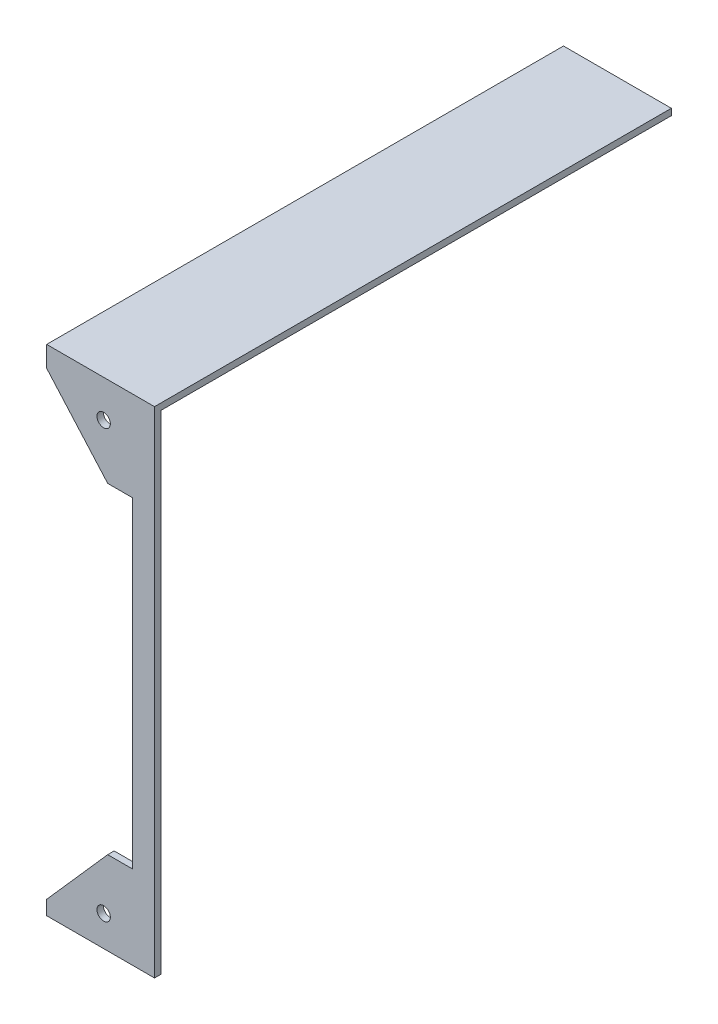
from build123d import *

# Parameters (mm, degrees)
BOSS_EXTRUDE1_DEPTH = 1.5875
SKETCH2_W           = 26.5
SKETCH2_H           = 127
BOSS_EXTRUDE2_DEPTH = 1.5875


with BuildPart() as part:
    # Sketch1 → Boss-Extrude1 (new body)
    with BuildSketch(Plane.XY):
        Polygon((-26.5, 120), (0, 120), (0, 0), (-26.5, 0), (-26.5, 3.5), (-11.5, 20.5), (-5.4, 20.5), (-5.4, 99.5), (-11.5, 99.5), (-26.5, 116.5), align=None)
        with BuildLine():
            ThreePointArc((-14.15, 112.5), (-12.5, 110.85), (-10.85, 112.5))
            ThreePointArc((-10.85, 112.5), (-12.5, 114.15), (-14.15, 112.5))
        make_face(mode=Mode.SUBTRACT)
        with BuildLine():
            ThreePointArc((-14.15, 7.5), (-12.5, 5.85), (-10.85, 7.5))
            ThreePointArc((-10.85, 7.5), (-12.5, 9.15), (-14.15, 7.5))
        make_face(mode=Mode.SUBTRACT)
    extrude(amount=BOSS_EXTRUDE1_DEPTH)

    # Sketch2 → Boss-Extrude2 (add)
    with BuildSketch(Plane(origin=(0, 120, 0), x_dir=(1, 0, 0), z_dir=(0, 1, 0))):
        with Locations((-13.25, 61.9125)):
            Rectangle(SKETCH2_W, SKETCH2_H)
    extrude(amount=BOSS_EXTRUDE2_DEPTH)


solid = part.part
